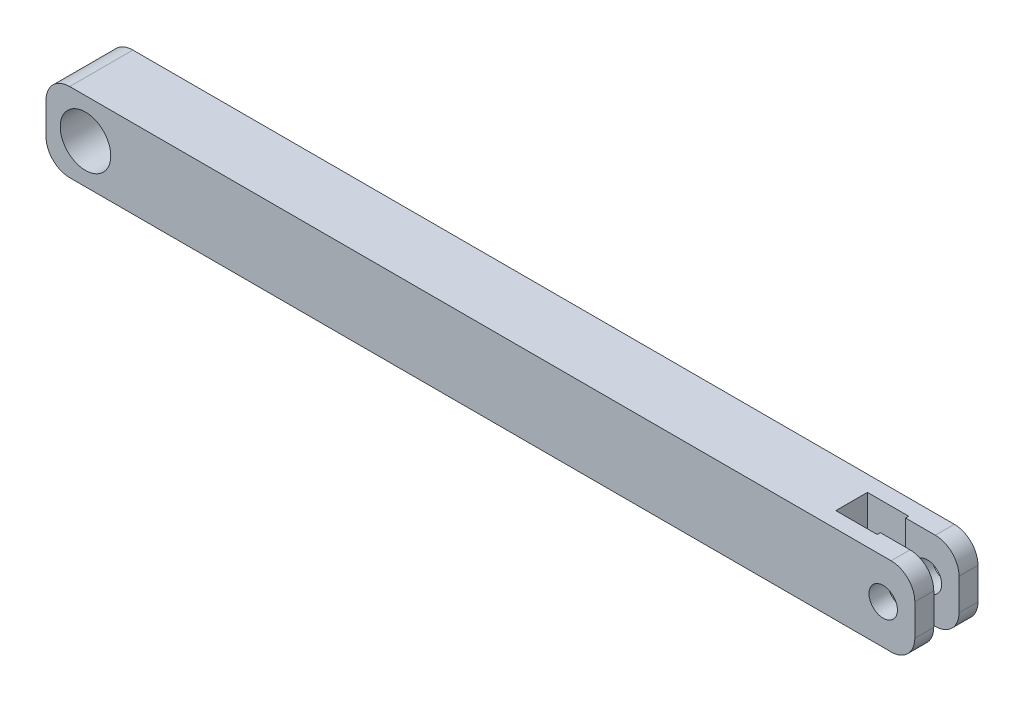
from build123d import *

# Parameters (mm, degrees)
SKETCH_5_W          = 55
SKETCH_5_H          = 3
EXTRUDE_1_DEPTH     = 5
CUT_EXTRUDE_1_REACH = 57.308
SKETCH_6_R          = 1.6
CUT_EXTRUDE_2_REACH = 57.308
SKETCH_7_R          = 0.9
FILLET_1_R          = 1.5
SKETCH_8_W          = 6
SKETCH_8_H          = 1.6
CUT_EXTRUDE_3_DEPTH = 10
SKETCH_9_W          = 2.616592429
SKETCH_9_H          = 0.2
CUT_EXTRUDE_4_DEPTH = 10
SKETCH_10_R         = 1.6
SKETCH_10_R_2       = 0.9
EXTRUDE_2_DEPTH     = 0.5
EXTRUDE_START       = 0.5
SKETCH_11_R         = 0.9
SKETCH_11_R_2       = 1.6
EXTRUDE_3_DEPTH     = 0.5


with BuildPart() as part:
    # 草图5 → 凸台-拉伸1 (new body)
    with BuildSketch(Plane(origin=(0, 0, 0), x_dir=(1, 0, 0), z_dir=(0, 1, 0))):
        with Locations((27.5, -1.5)):
            Rectangle(SKETCH_5_W, SKETCH_5_H)
    extrude(amount=EXTRUDE_1_DEPTH)

    # 草图6 → 切除-拉伸1 (cut, up to next)
    with BuildSketch(Plane.XY.offset(3), mode=Mode.PRIVATE) as cut_extrude_1_sk1:
        with Locations((2.5, 2.5)):
            Circle(SKETCH_6_R)
    cut_extrude_1_tool1 = extrude(cut_extrude_1_sk1.sketch, amount=-CUT_EXTRUDE_1_REACH, mode=Mode.PRIVATE) & part.part
    add(cut_extrude_1_tool1.solids().sort_by_distance((2.5, 2.5, 3))[0], mode=Mode.SUBTRACT)

    # 草图7 → 切除-拉伸2 (cut, up to next)
    with BuildSketch(Plane.XY, mode=Mode.PRIVATE) as cut_extrude_2_sk1:
        with Locations(Location((53, 2.5, 0), (0, 0, 180))):
            Circle(SKETCH_7_R)
    cut_extrude_2_tool1 = extrude(cut_extrude_2_sk1.sketch, amount=CUT_EXTRUDE_2_REACH, mode=Mode.PRIVATE) & part.part
    add(cut_extrude_2_tool1.solids().sort_by_distance((53, 2.5, 0))[0], mode=Mode.SUBTRACT)

    # 圆角1
    fillet_1_edges = [part.edges().sort_by_distance(p)[0] for p in [
        (55, 5, 1.5),
        (55, 0, 1.5),
        (0, 0, 1.5),
        (0, 5, 1.5),
    ]]
    fillet(fillet_1_edges, radius=FILLET_1_R)

    # 草图8 → 切除-拉伸3 (cut)
    with BuildSketch(Plane(origin=(0, 5, 0), x_dir=(1, 0, 0), z_dir=(0, 1, 0))):
        with Locations((52, -1.5)):
            Rectangle(SKETCH_8_W, SKETCH_8_H)
    extrude(amount=-CUT_EXTRUDE_3_DEPTH, mode=Mode.SUBTRACT)

    # 草图9 → 切除-拉伸4 (cut)
    with BuildSketch(Plane.XZ):
        with Locations((50.308296215, 0.6)):
            Rectangle(SKETCH_9_W, SKETCH_9_H)
        with Locations((50.308296215, 2.4)):
            Rectangle(SKETCH_9_W, SKETCH_9_H)
    extrude(amount=-CUT_EXTRUDE_4_DEPTH, mode=Mode.SUBTRACT)

    # 草图10 → 凸台-拉伸2 (add)
    with BuildSketch(Plane.XY.offset(3)):
        with BuildLine():
            Line((55, 1.5), (55, 3.5))
            ThreePointArc((55, 3.5), (54.560660172, 4.560660172), (53.5, 5))
            Line((53.5, 5), (1.5, 5))
            ThreePointArc((1.5, 5), (0.439339828, 4.560660172), (0, 3.5))
            Line((0, 3.5), (0, 1.5))
            ThreePointArc((0, 1.5), (0.439339828, 0.439339828), (1.5, 0))
            Line((1.5, 0), (53.5, 0))
            ThreePointArc((53.5, 0), (54.560660172, 0.439339828), (55, 1.5))
        make_face()
        with Locations((2.5, 2.5)):
            Circle(SKETCH_10_R, mode=Mode.SUBTRACT)
        with Locations((53, 2.5)):
            Circle(SKETCH_10_R_2, mode=Mode.SUBTRACT)
    extrude(amount=EXTRUDE_2_DEPTH)

    # 草图11 → 凸台-拉伸3 (add)
    with BuildSketch(Plane(origin=(0, 0, 0), x_dir=(-1, 0, 0), z_dir=(0, 0, -1)).offset(EXTRUDE_START)):
        with BuildLine():
            Line((-1.5, 5), (-53.5, 5))
            ThreePointArc((-53.5, 5), (-54.560660172, 4.560660172), (-55, 3.5))
            Line((-55, 3.5), (-55, 1.5))
            ThreePointArc((-55, 1.5), (-54.560660172, 0.439339828), (-53.5, 0))
            Line((-53.5, 0), (-1.5, 0))
            ThreePointArc((-1.5, 0), (-0.439339828, 0.439339828), (0, 1.5))
            Line((0, 1.5), (0, 3.5))
            ThreePointArc((0, 3.5), (-0.439339828, 4.560660172), (-1.5, 5))
        make_face()
        with Locations(Location((-53, 2.5, 0), (0, 0, 180))):
            Circle(SKETCH_11_R, mode=Mode.SUBTRACT)
        with Locations(Location((-2.5, 2.5, 0), (0, 0, 180))):
            Circle(SKETCH_11_R_2, mode=Mode.SUBTRACT)
    extrude(amount=-EXTRUDE_3_DEPTH)


solid = part.part
